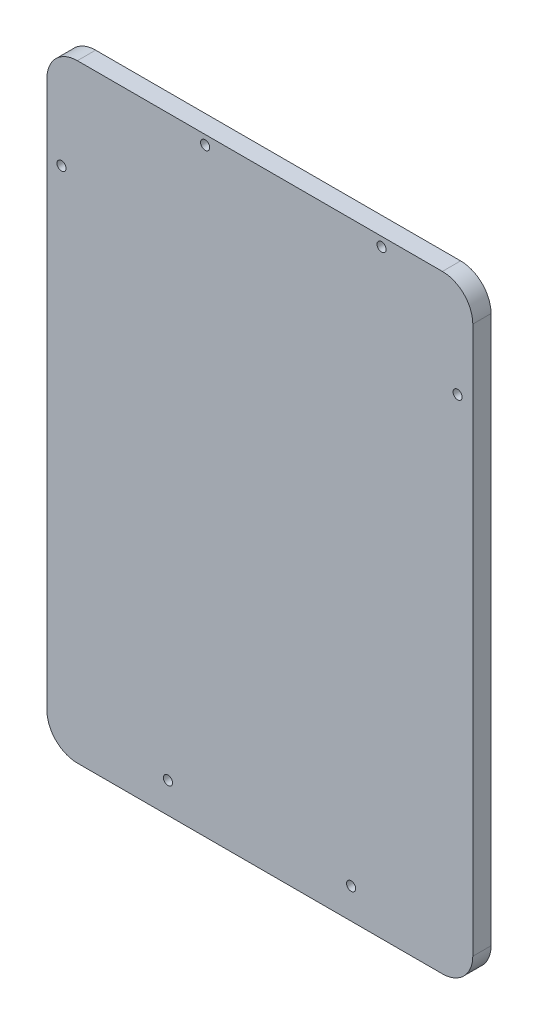
from build123d import *

# Parameters (mm, degrees)
SKETCH1_W           = 140
SKETCH1_H           = 200
BOSS_EXTRUDE1_DEPTH = 6
FILLET1_R           = 10
SKETCH2_R           = 1.5
CUT_EXTRUDE1_DEPTH  = 10
SKETCH3_R           = 1.5
CUT_EXTRUDE2_DEPTH  = 10


with BuildPart() as part:
    # Sketch1 → Boss-Extrude1 (new body)
    with BuildSketch(Plane.XY):
        with Locations((70, 100)):
            Rectangle(SKETCH1_W, SKETCH1_H)
    extrude(amount=BOSS_EXTRUDE1_DEPTH)

    # Fillet1
    fillet1_edges = [part.edges().sort_by_distance(p)[0] for p in [
        (0, 200, 3),
        (140, 200, 3),
        (140, 0, 3),
        (0, 0, 3),
    ]]
    fillet(fillet1_edges, radius=FILLET1_R)

    # Sketch2 → Cut-Extrude1 (cut)
    with BuildSketch(Plane(origin=(0, 0, 0), x_dir=(-1, 0, 0), z_dir=(0, 0, -1))):
        with Locations((-100, 10)):
            Circle(SKETCH2_R)
        with Locations((-39.78, 10)):
            Circle(SKETCH2_R)
        with Locations((-135, 167.45)):
            Circle(SKETCH2_R)
        with Locations((-4.78, 167.45)):
            Circle(SKETCH2_R)
    extrude(amount=-CUT_EXTRUDE1_DEPTH, mode=Mode.SUBTRACT)

    # Sketch3 → Cut-Extrude2 (cut)
    with BuildSketch(Plane(origin=(0, 0, 0), x_dir=(-1, 0, 0), z_dir=(0, 0, -1))):
        with Locations((-110, 196.990300429)):
            Circle(SKETCH3_R)
        with Locations((-52, 196.990300429)):
            Circle(SKETCH3_R)
    extrude(amount=-CUT_EXTRUDE2_DEPTH, mode=Mode.SUBTRACT)


solid = part.part
